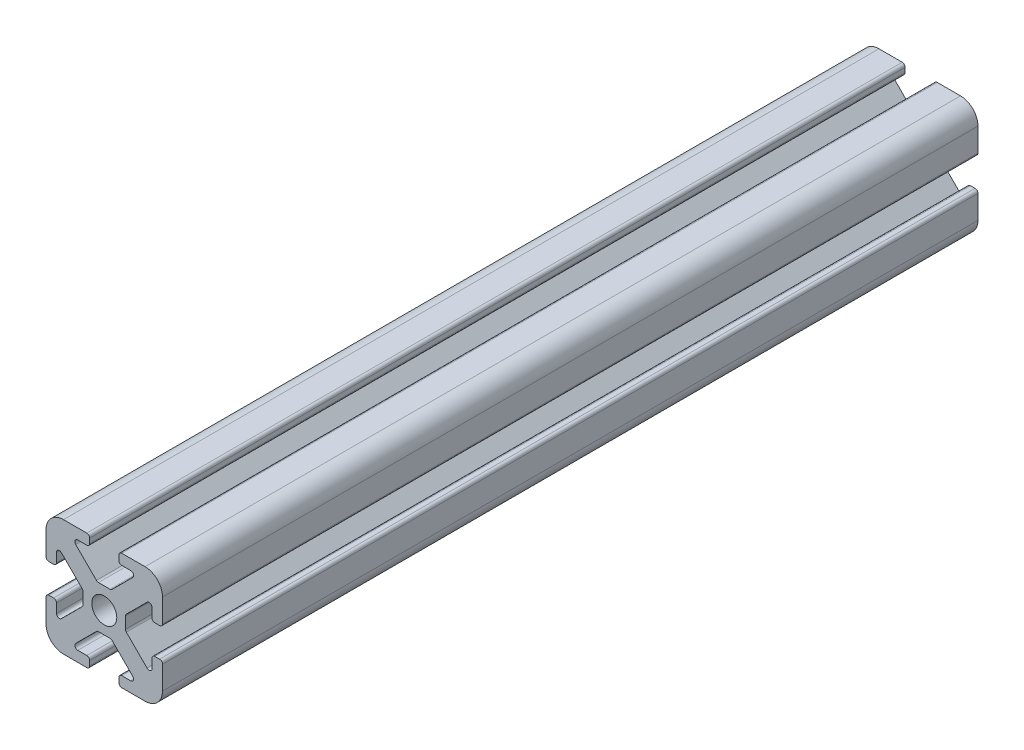
from build123d import *

# Parameters (mm, degrees)
SKETCH_1_W                       = 7.3
SKETCH_1_H                       = 7.3
SKETCH_1_R                       = 2.15
EXTRUDE_1_DEPTH                  = 140
EXTRUDE_2_DEPTH                  = 140
FILLET_1_R                       = 3
FILLET_2_R                       = 0.5
PATTERN_CIRCULAR_3_COUNT         = 4
FILLET_1_OF_PATTERN_CIRCULAR_3_R = 3
FILLET_2_OF_PATTERN_CIRCULAR_3_R = 0.5
FILLET_3_R                       = 0.5


with BuildPart() as part:
    # 草图1 → 凸台-拉伸1 (new body)
    with BuildSketch(Plane.XY):
        Rectangle(SKETCH_1_W, SKETCH_1_H)
        Circle(SKETCH_1_R, mode=Mode.SUBTRACT)
    extrude(amount=EXTRUDE_1_DEPTH)

    # 草图2 → 凸台-拉伸2 (add)
    with BuildSketch(Plane.XY):
        Polygon((2.5, 10), (2.5, 8.2), (5.75, 8.2), (1.2, 3.65), (3.65, 3.65), (3.65, 1.2), (8.2, 5.75), (8.2, 2.5), (10, 2.5), (10, 10), align=None)
    extrude_2 = extrude(amount=EXTRUDE_2_DEPTH)

    # 圆角1
    fillet_1_edges = [part.edges().sort_by_distance(p)[0] for p in [
        (10, 10, 70),
    ]]
    fillet(fillet_1_edges, radius=FILLET_1_R)

    # 圆角2
    fillet_2_edges = [part.edges().sort_by_distance(p)[0] for p in [
        (2.5, 10, 70),
        (2.5, 8.2, 70),
        (5.75, 8.2, 70),
        (8.2, 5.75, 70),
        (8.2, 2.5, 70),
        (10, 2.5, 70),
    ]]
    fillet(fillet_2_edges, radius=FILLET_2_R)

    # 阵列(圆周)3: 凸台-拉伸2 ×4 about axis
    pattern_circular_3_axis = Axis((0, 0, 0), (0, 0, 1))
    for i in range(1, PATTERN_CIRCULAR_3_COUNT):
        add(extrude_2.rotate(pattern_circular_3_axis, i * 360 / PATTERN_CIRCULAR_3_COUNT))

    # 圆角1 of 阵列(圆周)3
    fillet_1_of_pattern_circular_3_edges = [part.edges().sort_by_distance(p)[0] for p in [
        (-10, 10, 70),
        (-10, -10, 70),
        (10, -10, 70),
    ]]
    fillet(fillet_1_of_pattern_circular_3_edges, radius=FILLET_1_OF_PATTERN_CIRCULAR_3_R)

    # 圆角2 of 阵列(圆周)3
    fillet_2_of_pattern_circular_3_edges = [part.edges().sort_by_distance(p)[0] for p in [
        (-10, 2.5, 70),
        (-8.2, 2.5, 70),
        (-8.2, 5.75, 70),
        (-5.75, 8.2, 70),
        (-2.5, 8.2, 70),
        (-2.5, 10, 70),
        (-2.5, -10, 70),
        (-2.5, -8.2, 70),
        (-5.75, -8.2, 70),
        (-8.2, -5.75, 70),
        (-8.2, -2.5, 70),
        (-10, -2.5, 70),
        (10, -2.5, 70),
        (8.2, -2.5, 70),
        (8.2, -5.75, 70),
        (5.75, -8.2, 70),
        (2.5, -8.2, 70),
        (2.5, -10, 70),
    ]]
    fillet(fillet_2_of_pattern_circular_3_edges, radius=FILLET_2_OF_PATTERN_CIRCULAR_3_R)

    # 圆角3
    fillet_3_edges = [part.edges().sort_by_distance(p)[0] for p in [
        (-1.2, -3.65, 70),
        (-3.65, -1.2, 70),
        (-3.65, 1.2, 70),
        (-1.2, 3.65, 70),
        (1.2, 3.65, 70),
        (3.65, 1.2, 70),
        (3.65, -1.2, 70),
        (1.2, -3.65, 70),
    ]]
    fillet(fillet_3_edges, radius=FILLET_3_R)


solid = part.part
